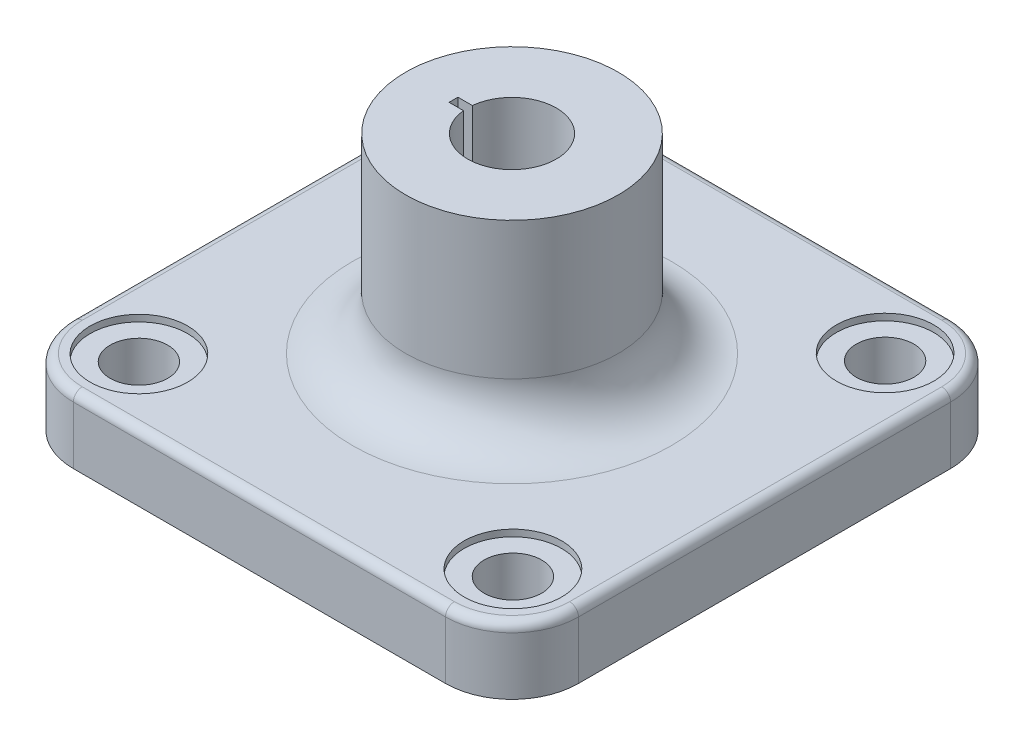
from build123d import *

# Parameters (mm, degrees)
SKETCH_1_W               = 114
SKETCH_1_H               = 15
EXTRUDE_1_DEPTH          = 114
FILLET_3_R               = 15
FILLET_4_R               = 2
SKETCH_2_R               = 24
EXTRUDE_2_DEPTH          = 43
FILLET_5_R               = 12
SKETCH_3_R               = 6.5
CUT_EXTRUDE_4_DEPTH      = 167.856225604
SKETCH_3_4_R             = 11
SKETCH_3_4_R_2           = 6.5
CUT_EXTRUDE_5_DEPTH      = 1.5
PATTERN_CIRCULAR_1_COUNT = 4


with BuildPart() as part:
    # 草圖1 → 填料-伸長1 (new body)
    with BuildSketch(Plane.XY):
        with Locations((57, -7.5)):
            Rectangle(SKETCH_1_W, SKETCH_1_H)
    extrude(amount=-EXTRUDE_1_DEPTH)

    # 圓角3
    fillet_3_edges = [part.edges().sort_by_distance(p)[0] for p in [
        (0, -7.5, -114),
        (0, -7.5, 0),
        (114, -7.5, -114),
        (114, -7.5, 0),
    ]]
    fillet(fillet_3_edges, radius=FILLET_3_R)

    # 圓角4
    fillet_4_edges = [part.edges().sort_by_distance(p)[0] for p in [
        (109.606601718, 0, -4.393398282),
        (114, 0, -57),
        (109.606601718, 0, -109.606601718),
        (57, 0, -114),
        (4.393398282, 0, -109.606601718),
        (0, 0, -57),
        (4.393398282, 0, -4.393398282),
        (57, 0, 0),
    ]]
    fillet(fillet_4_edges, radius=FILLET_4_R)

    # 草圖2 → 填料-伸長2 (add)
    with BuildSketch(Plane(origin=(0, 0, 0), x_dir=(1, 0, 0), z_dir=(0, 1, 0))):
        with Locations((57, 57)):
            Circle(SKETCH_2_R)
        with BuildLine():
            Line((43.8, 58), (47.050125629, 58))
            ThreePointArc((47.050125629, 58), (67, 57), (47.050125629, 56))
            Line((47.050125629, 56), (43.8, 56))
            Line((43.8, 56), (43.8, 58))
        make_face(mode=Mode.SUBTRACT)
    extrude(amount=EXTRUDE_2_DEPTH)

    # 圓角5
    fillet_5_edges = [part.edges().sort_by_distance(p)[0] for p in [
        (33, 0, -57),
    ]]
    fillet(fillet_5_edges, radius=FILLET_5_R)

    # 草圖3 → 除料-伸長4 (cut, through all)
    with BuildSketch(Plane(origin=(0, 0, 0), x_dir=(1, 0, 0), z_dir=(0, 1, 0))):
        with Locations((99, 99.206255551)):
            Circle(SKETCH_3_R)
    cut_extrude_4 = extrude(amount=-CUT_EXTRUDE_4_DEPTH, mode=Mode.SUBTRACT)

    # 草圖3<4> → 除料-伸長5 (cut)
    with BuildSketch(Plane(origin=(0, 0, 0), x_dir=(1, 0, 0), z_dir=(0, 1, 0))):
        with Locations((99, 99.206255551)):
            Circle(SKETCH_3_4_R)
        with Locations((99, 99.206255551)):
            Circle(SKETCH_3_4_R_2, mode=Mode.SUBTRACT)
    cut_extrude_5 = extrude(amount=-CUT_EXTRUDE_5_DEPTH, mode=Mode.SUBTRACT)

    # 環狀複製排列1: 除料-伸長4, 除料-伸長5 ×4 about axis
    pattern_circular_1_axis = Axis((57, 43, -57), (0, -1, 0))
    add([cut_extrude_4.rotate(pattern_circular_1_axis, i * 360 / PATTERN_CIRCULAR_1_COUNT) for i in range(1, PATTERN_CIRCULAR_1_COUNT)], mode=Mode.SUBTRACT)
    add([cut_extrude_5.rotate(pattern_circular_1_axis, i * 360 / PATTERN_CIRCULAR_1_COUNT) for i in range(1, PATTERN_CIRCULAR_1_COUNT)], mode=Mode.SUBTRACT)


solid = part.part
